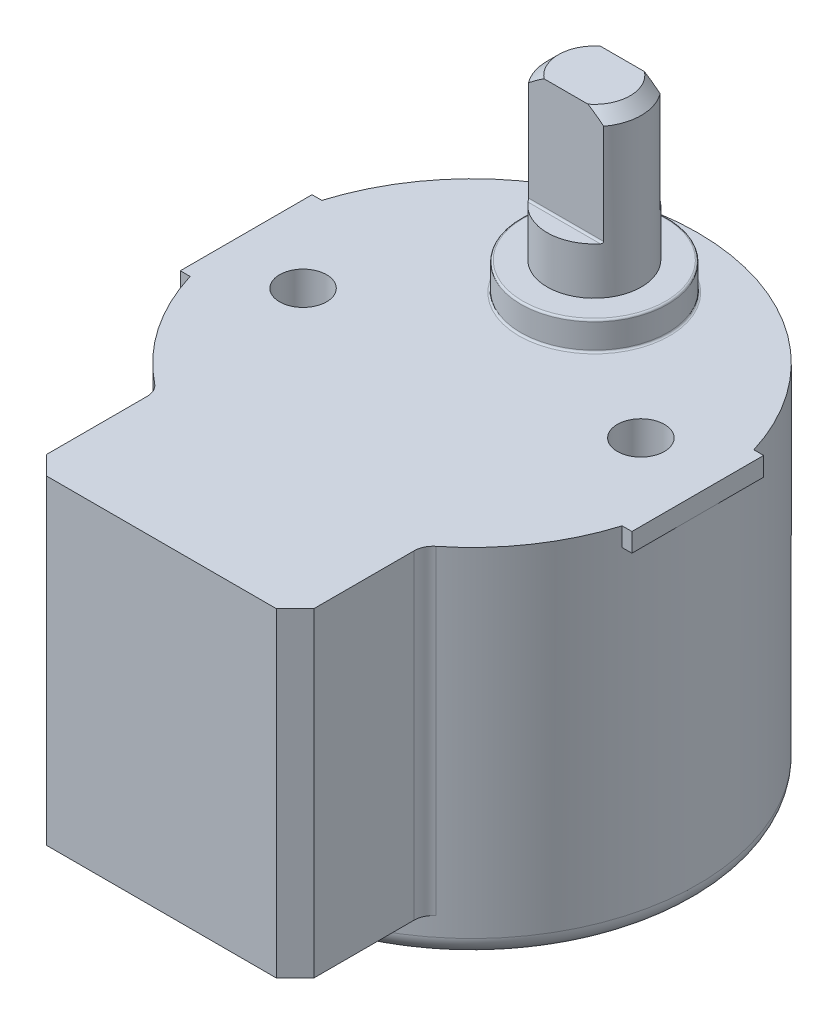
from build123d import *

# Parameters (mm, degrees)
SKETCH1_R           = 12
BOSS_EXTRUDE1_DEPTH = 19
SKETCH2_W           = 14.2
SKETCH2_H           = 7.594673869
BOSS_EXTRUDE2_DEPTH = 17
SKETCH3_R           = 2.05
BOSS_EXTRUDE3_DEPTH = 1
CHAMFER1_SIZE       = 0.6
SKETCH5_W           = 6
SKETCH5_H           = 2
CUT_EXTRUDE1_DEPTH  = 6
FILLET1_R           = 0.1
CHAMFER2_SIZE       = 1
FILLET2_R           = 1
FILLET3_R           = 0.1
FILLET4_R           = 1
SKETCH6_W           = 9.256543548
SKETCH6_H           = 10.153653495
CUT_EXTRUDE2_DEPTH  = 32.531730051
SKETCH8_R           = 1.25
CUT_EXTRUDE3_DEPTH  = 3


with BuildPart() as part:
    # Sketch1 → Boss-Extrude1 (new body)
    with BuildSketch(Plane(origin=(0, 0, 0), x_dir=(1, 0, 0), z_dir=(0, 1, 0))):
        with Locations(Location((0, 0, 0), (0, 0, 270))):
            Circle(SKETCH1_R)
    extrude(amount=BOSS_EXTRUDE1_DEPTH)

    # Sketch2 → Boss-Extrude2 (add)
    with BuildSketch(Plane(origin=(0, 2, 0), x_dir=(-1, 0, 0), z_dir=(0, -1, 0))):
        with Locations((0, -12.702663066)):
            Rectangle(SKETCH2_W, SKETCH2_H)
    extrude(amount=-BOSS_EXTRUDE2_DEPTH)

    # Sketch3 → Boss-Extrude3 (add)
    # profile 1 of 2: a face of its own
    with BuildSketch(Plane(origin=(0, 19, 0), x_dir=(1, 0, 0), z_dir=(0, 1, 0))):
        with BuildLine():
            Line((-15.5, -3.5), (-8, -3.5))
            Line((-8, -3.5), (-8, 3.5))
            Line((-8, 3.5), (-15.5, 3.5))
            ThreePointArc((-15.5, 3.5), (-19, 0), (-15.5, -3.5))
        make_face()
        with Locations(Location((-15.5, 0, 0), (0, 0, 270))):
            Circle(SKETCH3_R, mode=Mode.SUBTRACT)
    # profile 2 of 2: a face of its own
    with BuildSketch(Plane(origin=(0, 19, 0), x_dir=(1, 0, 0), z_dir=(0, 1, 0))):
        with BuildLine():
            Line((8, -3.5), (8, 3.5))
            Line((8, 3.5), (15.5, 3.5))
            ThreePointArc((15.5, 3.5), (19, 0), (15.5, -3.5))
            Line((15.5, -3.5), (8, -3.5))
        make_face()
        with Locations(Location((15.5, 0, 0), (0, 0, 90))):
            Circle(SKETCH3_R, mode=Mode.SUBTRACT)
    extrude(amount=-BOSS_EXTRUDE3_DEPTH)

    # Sketch4 → Revolve1 (revolve)
    with BuildSketch(Plane(origin=(0, 0, 0), x_dir=(0, 0, -1), z_dir=(1, 0, 0))):
        Polygon((6.5, 19), (2.6, 19), (2.6, 20.5), (4, 20.5), (4, 29), (6.5, 29), align=None)
    revolve(axis=Axis((0, 23.531707116, -6.5), (0, -1, 0)))

    # Chamfer1
    chamfer1_edges = [part.edges().sort_by_distance(p)[0] for p in [
        (0, 29, -9),
    ]]
    chamfer(chamfer1_edges, length=CHAMFER1_SIZE)

    # Sketch5 → Cut-Extrude1 (cut)
    with BuildSketch(Plane(origin=(0, 29, 0), x_dir=(1, 0, 0), z_dir=(0, 1, 0))):
        with Locations((0, 9)):
            Rectangle(SKETCH5_W, SKETCH5_H)
        with Locations((0, 4)):
            Rectangle(SKETCH5_W, SKETCH5_H)
    extrude(amount=-CUT_EXTRUDE1_DEPTH, mode=Mode.SUBTRACT)

    # Fillet1
    fillet1_edges = [part.edges().sort_by_distance(p)[0] for p in [
        (0, 23, -8),
        (0, 23, -5),
    ]]
    fillet(fillet1_edges, radius=FILLET1_R)

    # Chamfer2
    chamfer2_edges = [part.edges().sort_by_distance(p)[0] for p in [
        (-7.1, 10.5, 16.5),
        (7.1, 10.5, 16.5),
    ]]
    chamfer(chamfer2_edges, length=CHAMFER2_SIZE)

    # Fillet2
    fillet2_edges = [part.edges().sort_by_distance(p)[0] for p in [
        (7.1, 10.5, 9.674192473),
        (-7.1, 10.5, 9.674192473),
    ]]
    fillet(fillet2_edges, radius=FILLET2_R)

    # Fillet3
    fillet3_edges = [part.edges().sort_by_distance(p)[0] for p in [
        (0, 19, -10.4),
        (0, 20.5, -10.4),
    ]]
    fillet(fillet3_edges, radius=FILLET3_R)

    # Fillet4
    fillet4_edges = [part.edges().sort_by_distance(p)[0] for p in [
        (0, 0, -12),
    ]]
    fillet(fillet4_edges, radius=FILLET4_R)

    # Sketch6 → Cut-Extrude2 (cut, through all)
    with BuildSketch(Plane(origin=(0, 19, 0), x_dir=(1, 0, 0), z_dir=(0, 1, 0))):
        with Locations((-16.628271774, -0.333446931)):
            Rectangle(SKETCH6_W, SKETCH6_H)
        with Locations((16.628271774, -0.333446931)):
            Rectangle(SKETCH6_W, SKETCH6_H)
    extrude(amount=-CUT_EXTRUDE2_DEPTH, mode=Mode.SUBTRACT)

    # Sketch8 → Cut-Extrude3 (cut)
    with BuildSketch(Plane(origin=(0, 19, 0), x_dir=(1, 0, 0), z_dir=(0, 1, 0))):
        with Locations(Location((-7.931558639, -1.044209433, 0), (0, 0, 270))):
            Circle(SKETCH8_R)
        with Locations(Location((7.931559171, 1.044209433, 0), (0, 0, 270))):
            Circle(SKETCH8_R)
    extrude(amount=-CUT_EXTRUDE3_DEPTH, mode=Mode.SUBTRACT)


solid = part.part
